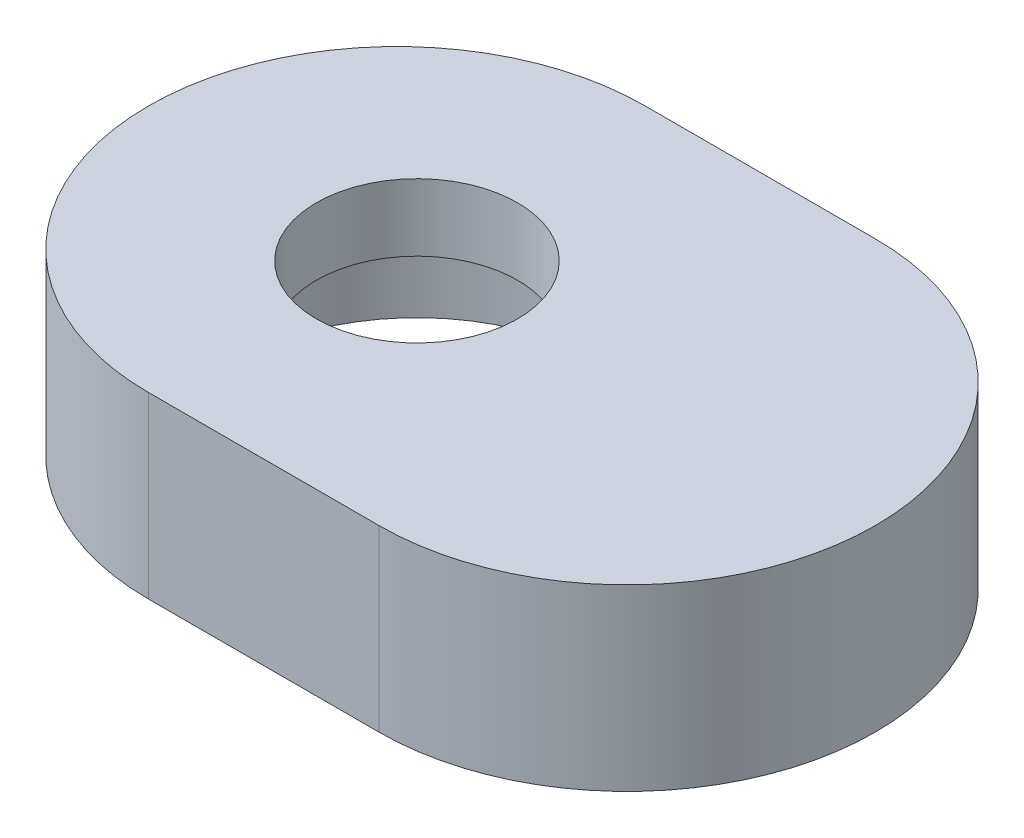
from build123d import *

# Parameters (mm, degrees)
SKETCH1_R           = 8.2
BOSS_EXTRUDE1_DEPTH = 8
BOSS_EXTRUDE2_START = -3
SKETCH2_R           = 8.2
SKETCH2_R_2         = 4.5
BOSS_EXTRUDE2_DEPTH = 3


with BuildPart() as part:
    # Sketch1 → Boss-Extrude1 (new body)
    with BuildSketch(Plane(origin=(0, 0, 0), x_dir=(1, 0, 0), z_dir=(0, 1, 0))):
        with BuildLine():
            Line((0, 11.1), (10.3, 11.1))
            ThreePointArc((10.3, 11.1), (21.4, 0), (10.3, -11.1))
            Line((10.3, -11.1), (0, -11.1))
            ThreePointArc((0, -11.1), (-11.1, 0), (0, 11.1))
        make_face()
        with Locations(Location((0.9, 0, 0), (0, 0, 270))):
            Circle(SKETCH1_R, mode=Mode.SUBTRACT)
    extrude(amount=BOSS_EXTRUDE1_DEPTH)

    # Sketch2 → Boss-Extrude2 (add)
    with BuildSketch(Plane(origin=(0, 8, 0), x_dir=(1, 0, 0), z_dir=(0, 1, 0)).offset(BOSS_EXTRUDE2_START)):
        with Locations(Location((0.9, 0, 0), (0, 0, 270))):
            Circle(SKETCH2_R)
        with Locations(Location((0.9, 0, 0), (0, 0, 270))):
            Circle(SKETCH2_R_2, mode=Mode.SUBTRACT)
    extrude(amount=BOSS_EXTRUDE2_DEPTH)


solid = part.part
